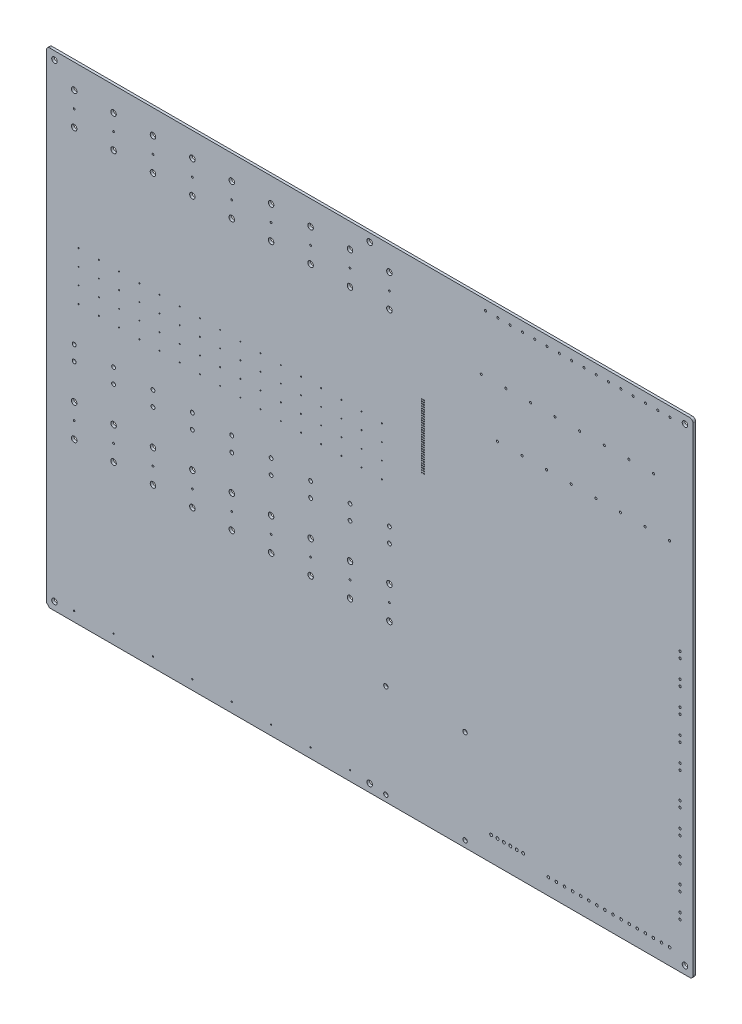
from build123d import *

# Parameters (mm, degrees)
SKETCH2_W                        = 400
SKETCH2_H                        = 300
BOSS_EXTRUDE2_DEPTH              = 1.6
FILLET1_R                        = 2
CHAMFER1_SIZE                    = 2
F_6_X_3_4_BOARD_FIXTURE_D        = 3.4
F_6_X_3_4_BOARD_FIXTURE_DEPTH    = 1.8
F_6_X_3_4_BOARD_FIXTURE_TIP      = 1.021463052
F_3_4_3_4_DIAMETER_HOLE3_D       = 3.4
F_3_4_3_4_DIAMETER_HOLE3_DEPTH   = 1.8
F_3_4_3_4_DIAMETER_HOLE3_TIP     = 1.021463052
F_1_1_1_1_DIAMETER_HOLE2_D       = 1.1
F_1_1_1_1_DIAMETER_HOLE2_DEPTH   = 1.8
F_1_1_1_1_DIAMETER_HOLE2_TIP     = 0.33047334
F_2_35_2_35_DIAMETER_HOLE1_D     = 2.35
F_2_35_2_35_DIAMETER_HOLE1_DEPTH = 1.8
F_2_35_2_35_DIAMETER_HOLE1_TIP   = 0.706011227
F_0_8_0_8_DIAMETER_HOLE1_D       = 0.8
F_0_8_0_8_DIAMETER_HOLE1_DEPTH   = 1.8
F_0_8_0_8_DIAMETER_HOLE1_TIP     = 0.240344248
F_2_7_2_7_DIAMETER_HOLE1_D       = 2.7
F_2_7_2_7_DIAMETER_HOLE1_DEPTH   = 1.8
F_2_7_2_7_DIAMETER_HOLE1_TIP     = 0.811161836
F_1_8_1_8_DIAMETER_HOLE1_D       = 1.8
F_1_8_1_8_DIAMETER_HOLE1_DEPTH   = 1.8
F_1_8_1_8_DIAMETER_HOLE1_TIP     = 0.540774557
F_1_6_1_6_DIAMETER_HOLE1_D       = 1.6
F_1_6_1_6_DIAMETER_HOLE1_DEPTH   = 1.8
F_1_6_1_6_DIAMETER_HOLE1_TIP     = 0.480688495
F_1_4_1_4_DIAMETER_HOLE1_D       = 1.4
F_1_4_1_4_DIAMETER_HOLE1_DEPTH   = 1.8
F_1_4_1_4_DIAMETER_HOLE1_TIP     = 0.420602433
LPATTERN1_COUNT                  = 16
LPATTERN1_PITCH                  = 7.61
F_1_3_1_3_DIAMETER_HOLE2_D       = 1.3
F_1_3_1_3_DIAMETER_HOLE2_DEPTH   = 1.8
F_1_3_1_3_DIAMETER_HOLE2_TIP     = 0.390559402
LPATTERN2_COUNT                  = 16
LPATTERN2_PITCH                  = 12.5
LPATTERN2_COUNT_DIR2             = 4
LPATTERN2_PITCH_DIR2             = 10
F_0_65_0_65_DIAMETER_HOLE2_D     = 0.65
LPATTERN3_COUNT                  = 32
LPATTERN3_PITCH                  = 1.27
LPATTERN3_COUNT_DIR2             = 2
LPATTERN3_PITCH_DIR2             = 1.27


with BuildPart() as part:
    # Sketch2 → Boss-Extrude2 (new body)
    with BuildSketch(Plane.XY):
        with Locations((230, 180)):
            Rectangle(SKETCH2_W, SKETCH2_H)
    extrude(amount=BOSS_EXTRUDE2_DEPTH)

    # Fillet1
    fillet1_edges = [part.edges().sort_by_distance(p)[0] for p in [
        (30, 330, 0.8),
        (430, 330, 0.8),
        (430, 30, 0.8),
    ]]
    fillet(fillet1_edges, radius=FILLET1_R)

    # Chamfer1
    chamfer1_edges = [part.edges().sort_by_distance(p)[0] for p in [
        (30, 30, 0.8),
    ]]
    chamfer(chamfer1_edges, length=CHAMFER1_SIZE)

    # 6 x _3.4 Board Fixture
    with Locations(Plane.XY.offset(1.6)):
        with Locations((35, 35), (230, 35), (425, 35), (425, 325), (230, 325), (35, 325)):
            Hole(F_6_X_3_4_BOARD_FIXTURE_D / 2, depth=F_6_X_3_4_BOARD_FIXTURE_DEPTH)
            with Locations((0, 0, -(F_6_X_3_4_BOARD_FIXTURE_DEPTH + F_6_X_3_4_BOARD_FIXTURE_TIP / 2))):  # 118° drill point
                Cone(0, F_6_X_3_4_BOARD_FIXTURE_D / 2, F_6_X_3_4_BOARD_FIXTURE_TIP, mode=Mode.SUBTRACT)

    # Ø3.4 (3.4) Diameter Hole3
    with Locations(Plane.XY.offset(1.6)):
        with Locations((47.188, 314.956), (71.563, 314.956), (95.938, 314.956), (120.313, 314.956), (144.688, 314.956), (169, 314.956), (193.446, 314.956), (217.812, 314.956), (242.188, 314.956), (47.188, 294.956), (71.563, 294.956), (95.938, 294.956), (120.313, 294.956), (144.688, 294.956), (169, 294.956), (193.446, 294.956), (217.812, 294.956), (242.188, 294.956), (47.188, 147.956), (71.563, 147.956), (95.938, 147.956), (120.313, 147.956), (144.688, 147.956), (169, 147.956), (193.446, 147.956), (217.812, 147.956), (242.188, 147.956), (242.188, 127.956), (217.812, 127.956), (193.446, 127.956), (169, 127.956), (144.688, 127.956), (120.313, 127.956), (95.938, 127.956), (71.563, 127.956), (47.188, 127.956)):
            Hole(F_3_4_3_4_DIAMETER_HOLE3_D / 2, depth=F_3_4_3_4_DIAMETER_HOLE3_DEPTH)
            with Locations((0, 0, -(F_3_4_3_4_DIAMETER_HOLE3_DEPTH + F_3_4_3_4_DIAMETER_HOLE3_TIP / 2))):  # 118° drill point
                Cone(0, F_3_4_3_4_DIAMETER_HOLE3_D / 2, F_3_4_3_4_DIAMETER_HOLE3_TIP, mode=Mode.SUBTRACT)

    # Ø1.1 (1.1) Diameter Hole2
    with Locations(Plane.XY.offset(1.6)):
        with Locations((47.188, 304.956), (71.563, 304.956), (95.938, 304.956), (120.313, 304.956), (144.688, 304.956), (169, 304.956), (193.446, 304.956), (217.812, 304.956), (242.188, 304.956), (47.188, 137.956), (71.563, 137.956), (95.938, 137.956), (120.313, 137.956), (144.688, 137.956), (169, 137.956), (193.446, 137.956), (217.812, 137.956), (242.188, 137.956)):
            Hole(F_1_1_1_1_DIAMETER_HOLE2_D / 2, depth=F_1_1_1_1_DIAMETER_HOLE2_DEPTH)
            with Locations((0, 0, -(F_1_1_1_1_DIAMETER_HOLE2_DEPTH + F_1_1_1_1_DIAMETER_HOLE2_TIP / 2))):  # 118° drill point
                Cone(0, F_1_1_1_1_DIAMETER_HOLE2_D / 2, F_1_1_1_1_DIAMETER_HOLE2_TIP, mode=Mode.SUBTRACT)

    # Ø2.35 (2.35) Diameter Hole1
    with Locations(Plane.XY.offset(1.6)):
        with Locations((47.188, 178.778), (71.563, 178.778), (95.938, 178.778), (120.313, 178.778), (144.688, 178.778), (169, 178.778), (193.446, 178.778), (217.812, 178.778), (242.188, 178.778), (47.188, 169.628), (71.563, 169.628), (95.938, 169.628), (120.313, 169.628), (144.688, 169.628), (169, 169.628), (193.446, 169.628), (217.812, 169.628), (242.188, 169.628)):
            Hole(F_2_35_2_35_DIAMETER_HOLE1_D / 2, depth=F_2_35_2_35_DIAMETER_HOLE1_DEPTH)
            with Locations((0, 0, -(F_2_35_2_35_DIAMETER_HOLE1_DEPTH + F_2_35_2_35_DIAMETER_HOLE1_TIP / 2))):  # 118° drill point
                Cone(0, F_2_35_2_35_DIAMETER_HOLE1_D / 2, F_2_35_2_35_DIAMETER_HOLE1_TIP, mode=Mode.SUBTRACT)

    # Ø0.8 (0.8) Diameter Hole1
    with Locations(Plane.XY.offset(1.6)):
        with Locations((47.188, 36), (71.563, 36), (95.938, 36), (120.313, 36), (144.688, 36), (169, 36), (193.446, 36), (217.812, 36)):
            Hole(F_0_8_0_8_DIAMETER_HOLE1_D / 2, depth=F_0_8_0_8_DIAMETER_HOLE1_DEPTH)
            with Locations((0, 0, -(F_0_8_0_8_DIAMETER_HOLE1_DEPTH + F_0_8_0_8_DIAMETER_HOLE1_TIP / 2))):  # 118° drill point
                Cone(0, F_0_8_0_8_DIAMETER_HOLE1_D / 2, F_0_8_0_8_DIAMETER_HOLE1_TIP, mode=Mode.SUBTRACT)

    # Ø2.7 (2.7) Diameter Hole1
    with Locations(Plane.XY.offset(1.6)):
        with Locations((239.994, 34), (239.994, 92), (288.994, 92), (288.994, 34)):
            Hole(F_2_7_2_7_DIAMETER_HOLE1_D / 2, depth=F_2_7_2_7_DIAMETER_HOLE1_DEPTH)
            with Locations((0, 0, -(F_2_7_2_7_DIAMETER_HOLE1_DEPTH + F_2_7_2_7_DIAMETER_HOLE1_TIP / 2))):  # 118° drill point
                Cone(0, F_2_7_2_7_DIAMETER_HOLE1_D / 2, F_2_7_2_7_DIAMETER_HOLE1_TIP, mode=Mode.SUBTRACT)

    # Ø1.8 (1.8) Diameter Hole1
    with Locations(Plane.XY.offset(1.6)):
        with Locations((305.1, 45), (309.06, 45), (313.02, 45), (316.98, 45), (320.94, 45), (324.9, 45)):
            Hole(F_1_8_1_8_DIAMETER_HOLE1_D / 2, depth=F_1_8_1_8_DIAMETER_HOLE1_DEPTH)
            with Locations((0, 0, -(F_1_8_1_8_DIAMETER_HOLE1_DEPTH + F_1_8_1_8_DIAMETER_HOLE1_TIP / 2))):  # 118° drill point
                Cone(0, F_1_8_1_8_DIAMETER_HOLE1_D / 2, F_1_8_1_8_DIAMETER_HOLE1_TIP, mode=Mode.SUBTRACT)

    # Ø1.6 (1.6) Diameter Hole1
    with Locations(Plane.XY.offset(1.6)):
        with Locations((340.5, 40), (345.5, 40), (350.5, 40), (355.5, 40), (360.5, 40), (365.5, 40), (370.5, 40), (375.5, 40), (380.5, 40), (385.5, 40), (390.5, 40), (395.5, 40), (400.5, 40), (405.5, 40), (410.5, 40), (415.5, 40)):
            Hole(F_1_6_1_6_DIAMETER_HOLE1_D / 2, depth=F_1_6_1_6_DIAMETER_HOLE1_DEPTH)
            with Locations((0, 0, -(F_1_6_1_6_DIAMETER_HOLE1_DEPTH + F_1_6_1_6_DIAMETER_HOLE1_TIP / 2))):  # 118° drill point
                Cone(0, F_1_6_1_6_DIAMETER_HOLE1_D / 2, F_1_6_1_6_DIAMETER_HOLE1_TIP, mode=Mode.SUBTRACT)

    # Ø1.4 (1.4) Diameter Hole1
    with Locations(Plane.XY.offset(1.6)):
        with Locations((422, 58.095), (422, 61.895), (422, 73.085), (422, 76.885), (422, 88.075), (422, 91.875), (422, 103.065), (422, 106.865), (422, 118.055), (422, 121.855), (422, 138.045), (422, 141.845), (422, 153.035), (422, 156.835), (422, 168.025), (422, 171.825), (422, 183.015), (422, 186.815), (422, 198.005), (422, 201.805)):
            Hole(F_1_4_1_4_DIAMETER_HOLE1_D / 2, depth=F_1_4_1_4_DIAMETER_HOLE1_DEPTH)
            with Locations((0, 0, -(F_1_4_1_4_DIAMETER_HOLE1_DEPTH + F_1_4_1_4_DIAMETER_HOLE1_TIP / 2))):  # 118° drill point
                Cone(0, F_1_4_1_4_DIAMETER_HOLE1_D / 2, F_1_4_1_4_DIAMETER_HOLE1_TIP, mode=Mode.SUBTRACT)

    # Sketch29 → Ø1.3 (1.3) Diameter Hole1 (revolve, cut)
    with BuildSketch(Plane(origin=(301.655, 324, 1.6), x_dir=(0, -1, 0), z_dir=(1, 0, 0))):
        Polygon((0, 0), (0, 2.190559402), (0.65, 1.8), (0.65, 0), align=None)
    f_1_3_1_3_diameter_hole1 = revolve(axis=Axis((301.655, 324, 7.95), (0, 0, -1)), mode=Mode.SUBTRACT)

    # LPattern1: Ø1.3 (1.3) Diameter Hole1 ×16
    with Locations(*[(i * LPATTERN1_PITCH, 0, 0) for i in range(1, LPATTERN1_COUNT)]):
        add(f_1_3_1_3_diameter_hole1, mode=Mode.SUBTRACT)

    # Ø1.3 (1.3) Diameter Hole2
    with Locations(Plane.XY.offset(1.6)):
        with Locations((309, 257.7), (324.22, 257.7), (339.44, 257.7), (354.66, 257.7), (369.88, 257.7), (385.1, 257.7), (400.32, 257.7), (415.54, 257.7), (299, 288.7), (314.22, 288.7), (329.44, 288.7), (344.66, 288.7), (359.88, 288.7), (375.1, 288.7), (390.32, 288.7), (405.54, 288.7)):
            Hole(F_1_3_1_3_DIAMETER_HOLE2_D / 2, depth=F_1_3_1_3_DIAMETER_HOLE2_DEPTH)
            with Locations((0, 0, -(F_1_3_1_3_DIAMETER_HOLE2_DEPTH + F_1_3_1_3_DIAMETER_HOLE2_TIP / 2))):  # 118° drill point
                Cone(0, F_1_3_1_3_DIAMETER_HOLE2_D / 2, F_1_3_1_3_DIAMETER_HOLE2_TIP, mode=Mode.SUBTRACT)

    # Sketch33 → Ø0.65 (0.65) Diameter Hole1 (revolve, cut)
    with BuildSketch(Plane(origin=(50, 201.698, 1.6), x_dir=(0, -1, 0), z_dir=(1, 0, 0))):
        Polygon((0, 0), (0, 1.995279701), (0.325, 1.8), (0.325, 0), align=None)
    f_0_65_0_65_diameter_hole1 = revolve(axis=Axis((50, 201.698, 7.95), (0, 0, -1)), mode=Mode.SUBTRACT)

    # LPattern2: 0.65 _0.65_ Diameter Hole1 16 × 4
    with Locations(*[(i * LPATTERN2_PITCH, j * LPATTERN2_PITCH_DIR2, 0) for i in range(LPATTERN2_COUNT) for j in range(LPATTERN2_COUNT_DIR2) if (i, j) != (0, 0)]):
        add(f_0_65_0_65_diameter_hole1, mode=Mode.SUBTRACT)

    # Ø0.65 (0.65) Diameter Hole2 (through all)
    with Locations(Plane.XY.offset(1.6)):
        with Locations((262.268, 257.085)):
            f_0_65_0_65_diameter_hole2 = Hole(F_0_65_0_65_DIAMETER_HOLE2_D / 2)

    # LPattern3: 0.65 _0.65_ Diameter Hole2 32 × 2
    with Locations(*[(j * LPATTERN3_PITCH_DIR2, -i * LPATTERN3_PITCH, 0) for i in range(LPATTERN3_COUNT) for j in range(LPATTERN3_COUNT_DIR2) if (i, j) != (0, 0)]):
        add(f_0_65_0_65_diameter_hole2, mode=Mode.SUBTRACT)


solid = part.part
